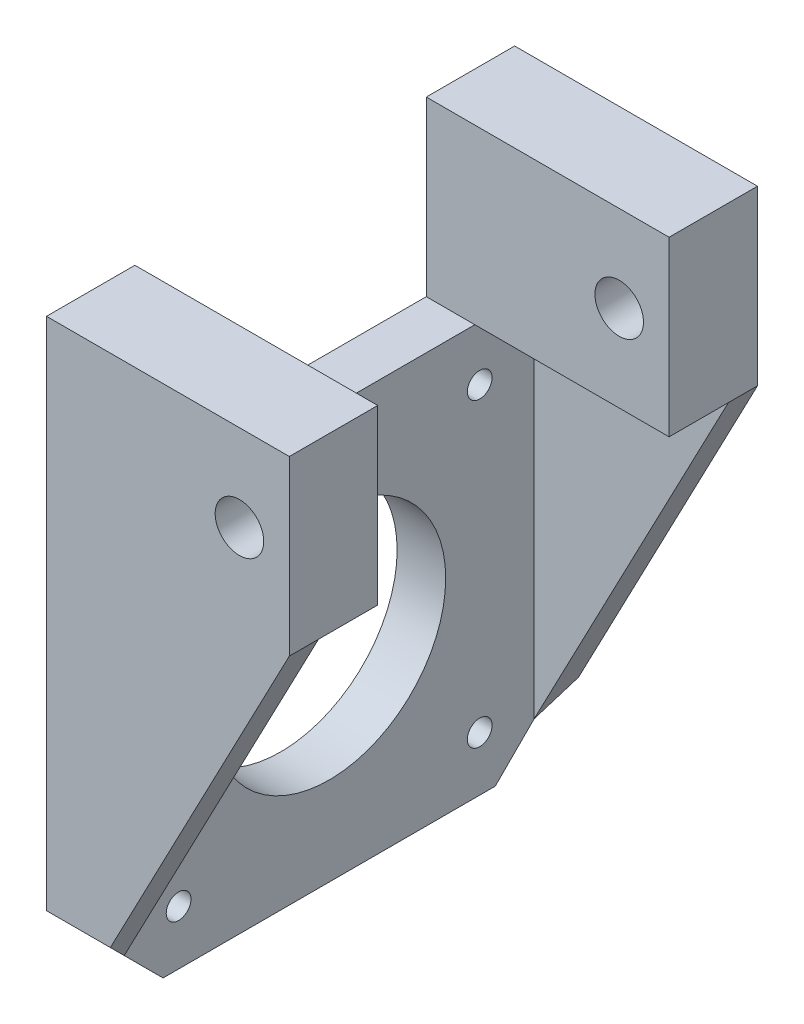
from build123d import *

# Parameters (mm, degrees)
SKETCH1_R           = 1.275
BOSS_EXTRUDE1_DEPTH = 5
SKETCH2_W           = 9.1
SKETCH2_H           = 17.8
BOSS_EXTRUDE2_DEPTH = 20
BOSS_EXTRUDE3_DEPTH = 3
CUT_EXTRUDE1_DEPTH  = 15
SKETCH5_R           = 2.5
CUT_EXTRUDE2_DEPTH  = 15
SKETCH7_W           = 24.2
SKETCH7_H           = 42.2
BOSS_EXTRUDE4_DEPTH = 5
SKETCH8_R           = 12
CUT_EXTRUDE3_DEPTH  = 5


with BuildPart() as part:
    # Sketch1 → Boss-Extrude1 (new body)
    with BuildSketch(Plane(origin=(0, 0, 0), x_dir=(0, 0, -1), z_dir=(1, 0, 0))):
        Polygon((-0.382647728, -30.17956484), (-0.382647728, 8.02143516), (2.617352272, 8.02143516), (2.617352272, 25.82143516), (-6.482647728, 25.82143516), (-6.482647728, 8.02143516), (-9.382647728, 8.02143516), (-9.382647728, -34.17856484), (-4.381647728, -34.17856484), align=None)
        with Locations((-5.982647728, -28.57856484)):
            Circle(SKETCH1_R, mode=Mode.SUBTRACT)
        with Locations((-5.982647728, 2.42143516)):
            Circle(SKETCH1_R, mode=Mode.SUBTRACT)
    extrude(amount=BOSS_EXTRUDE1_DEPTH)

    # Sketch2 → Boss-Extrude2 (add)
    with BuildSketch(Plane(origin=(5, 0, 0), x_dir=(0, 0, -1), z_dir=(1, 0, 0))):
        with Locations((-1.932647728, 16.92143516)):
            Rectangle(SKETCH2_W, SKETCH2_H)
    extrude(amount=BOSS_EXTRUDE2_DEPTH)

    # Sketch3 → Boss-Extrude3 (add)
    with BuildSketch(Plane(origin=(0, 0, 0.382647728), x_dir=(-1, 0, 0), z_dir=(0, 0, -1))):
        Polygon((-25, 8.02143516), (0, 8.02143516), (0, -30.17956484), (-5, -30.17956484), align=None)
    extrude(amount=BOSS_EXTRUDE3_DEPTH)

    # Sketch4 → Cut-Extrude1 (cut, symmetric)
    with BuildSketch(Plane(origin=(5, 0, 0), x_dir=(0, 0, -1), z_dir=(1, 0, 0))):
        Polygon((-0.382647728, -30.17956484), (2.617352272, -27.17956484), (2.617352272, -30.17956484), align=None)
    extrude(amount=CUT_EXTRUDE1_DEPTH, both=True, mode=Mode.SUBTRACT)

    # Sketch5 → Cut-Extrude2 (cut, symmetric)
    with BuildSketch(Plane(origin=(0, 0, -2.617352272), x_dir=(-1, 0, 0), z_dir=(0, 0, -1))):
        with Locations((-19.86272871, 16.92143516)):
            Circle(SKETCH5_R)
    extrude(amount=CUT_EXTRUDE2_DEPTH, both=True, mode=Mode.SUBTRACT)


with BuildPart() as body_2:
    # Mirror14: mirrored copy
    add(part.part.mirror(Plane.XY.offset(21.482647728)))


with BuildPart() as part_1:
    add(part.part)

    add(body_2.part)  # Boss-Extrude4 merges body 2
    # Sketch7 → Boss-Extrude4 (add)
    with BuildSketch(Plane(origin=(5, 0, 0), x_dir=(0, 0, -1), z_dir=(1, 0, 0))):
        with Locations((-21.482647728, -13.07856484)):
            Rectangle(SKETCH7_W, SKETCH7_H)
    extrude(amount=-BOSS_EXTRUDE4_DEPTH)

    # Sketch8 → Cut-Extrude3 (cut)
    with BuildSketch(Plane(origin=(5, 0, 0), x_dir=(0, 0, -1), z_dir=(1, 0, 0))):
        with Locations((-21.482647728, -13.07856484)):
            Circle(SKETCH8_R)
    extrude(amount=-CUT_EXTRUDE3_DEPTH, mode=Mode.SUBTRACT)


solid = part_1.part
